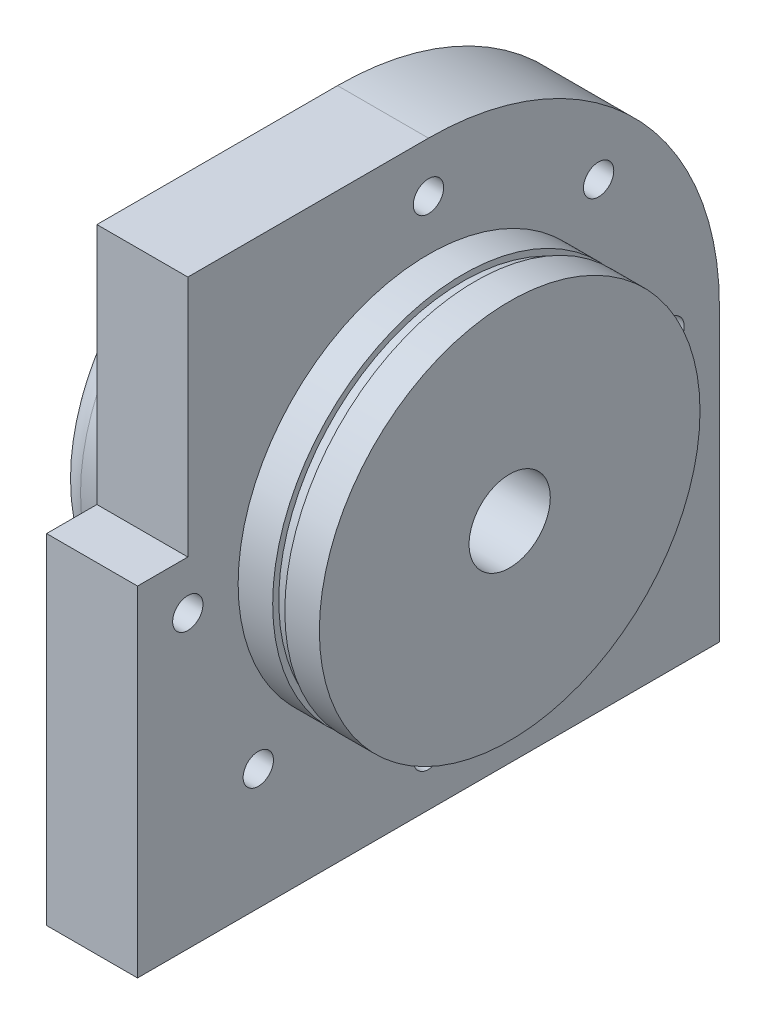
from build123d import *

# Parameters (mm, degrees)
SKETCH1_R                     = 39.878
HOUSING_FITTING_EXTRUDE_DEPTH = 17.018
HOUSING_BODY_1_DEPTH          = 19.05
SKETCH3_R                     = 8.509
IMPELLER_BORE_DEPTH           = 17.018
SKETCH4_R                     = 4
SHAFT_BORE_DEPTH              = 70.612
O_RING_CUT_DEPTH              = 1.27
O_RING_CUT_DEPTH_BACK         = 1.27
SKETCH5_R                     = 39.878
SKETCH5_R_2                   = 38.608
SEAL_START                    = 19.05
SKETCH7_R                     = 39.878
SKETCH7_R_2                   = 4
SEAL_SIDE_BODY_EXT_DEPTH      = 19.05
EXT_FILLET_R                  = 5.08
SKETCH10_W                    = 19.05
SKETCH10_H                    = 50.8
DISCHARGE_CUT_DEPTH           = 10.541
SKETCH11_R                    = 19.05
CUT_EXTRUDE1_DEPTH            = 27.94
SKETCH12_R                    = 3.175
CUT_EXTRUDE2_DEPTH            = 19.05
CIRPATTERN1_COUNT             = 8


with BuildPart() as part:
    # Sketch1 → Housing Fitting Extrude (new body)
    with BuildSketch(Plane(origin=(0, 0, 0), x_dir=(0, 0, -1), z_dir=(1, 0, 0))):
        Circle(SKETCH1_R)
    extrude(amount=HOUSING_FITTING_EXTRUDE_DEPTH)

    # Sketch2 → Housing Body 1 (add)
    with BuildSketch(Plane.ZY):
        with BuildLine():
            Line((60.96, 0), (60.96, 60.96))
            Line((60.96, 60.96), (0, 60.96))
            ThreePointArc((0, 60.96), (-43.105229381, 43.105229381), (-60.96, 0))
            Line((-60.96, 0), (-60.96, -54.61))
            Line((-60.96, -54.61), (-60.96, -60.96))
            Line((-60.96, -60.96), (60.96, -60.96))
            Line((60.96, -60.96), (60.96, -54.61))
            Line((60.96, -54.61), (60.96, 0))
        make_face()
    extrude(amount=HOUSING_BODY_1_DEPTH)

    # Sketch3 → Impeller Bore (cut)
    with BuildSketch(Plane(origin=(17.018, 0, 0), x_dir=(0, 0, -1), z_dir=(1, 0, 0))):
        Circle(SKETCH3_R)
    extrude(amount=-IMPELLER_BORE_DEPTH, mode=Mode.SUBTRACT)

    # Sketch4 → Shaft Bore (cut)
    with BuildSketch(Plane(origin=(0, 0, 0), x_dir=(0, 0, -1), z_dir=(1, 0, 0))):
        Circle(SKETCH4_R)
    extrude(amount=-SHAFT_BORE_DEPTH, mode=Mode.SUBTRACT)

    # Sketch5 → O-Ring Cut (cut, two sides: drawn at the far end of the back side and taken through both)
    with BuildSketch(Plane(origin=(8.509, 0, 0), x_dir=(0, 0, -1), z_dir=(1, 0, 0)).offset(-O_RING_CUT_DEPTH_BACK)):
        Circle(SKETCH5_R)
        Circle(SKETCH5_R_2, mode=Mode.SUBTRACT)
    extrude(amount=O_RING_CUT_DEPTH + O_RING_CUT_DEPTH_BACK, mode=Mode.SUBTRACT)

    # Sketch7 → Seal Side Body Ext (add)
    with BuildSketch(Plane.ZY.offset(19.05).offset(SEAL_START)):
        with Locations(Location((0, 0, 0), (0, 0, 180))):
            Circle(SKETCH7_R)
        with Locations(Location((0, 0, 0), (0, 0, 180))):
            Circle(SKETCH7_R_2, mode=Mode.SUBTRACT)
    extrude(amount=-SEAL_SIDE_BODY_EXT_DEPTH)

    # Ext Fillet
    ext_fillet_edges = [part.edges().sort_by_distance(p)[0] for p in [
        (-38.1, 0, 39.878),
        (-19.05, 0, 39.878),
    ]]
    fillet(ext_fillet_edges, radius=EXT_FILLET_R)

    # Sketch10 → Discharge Cut (cut)
    with BuildSketch(Plane.XY.offset(60.96)):
        with Locations((-9.525, 35.56)):
            Rectangle(SKETCH10_W, SKETCH10_H)
    extrude(amount=-DISCHARGE_CUT_DEPTH, mode=Mode.SUBTRACT)

    # Sketch11 → Cut-Extrude1 (cut)
    with BuildSketch(Plane.ZY.offset(38.1)):
        Circle(SKETCH11_R)
    extrude(amount=-CUT_EXTRUDE1_DEPTH, mode=Mode.SUBTRACT)

    # Sketch12 → Cut-Extrude2 (cut)
    with BuildSketch(Plane(origin=(0, 0, 0), x_dir=(0, 0, -1), z_dir=(1, 0, 0))):
        with Locations((-50.419, 0)):
            Circle(SKETCH12_R)
    cut_extrude2 = extrude(amount=-CUT_EXTRUDE2_DEPTH, mode=Mode.SUBTRACT)

    # CirPattern1: Cut-Extrude2 ×8 about axis, 1 skipped
    cirpattern1_axis = Axis((0, 0, 0), (1, 0, 0))
    add([cut_extrude2.rotate(cirpattern1_axis, i * 360 / CIRPATTERN1_COUNT) for i in range(1, CIRPATTERN1_COUNT) if i not in (7,)], mode=Mode.SUBTRACT)


solid = part.part
